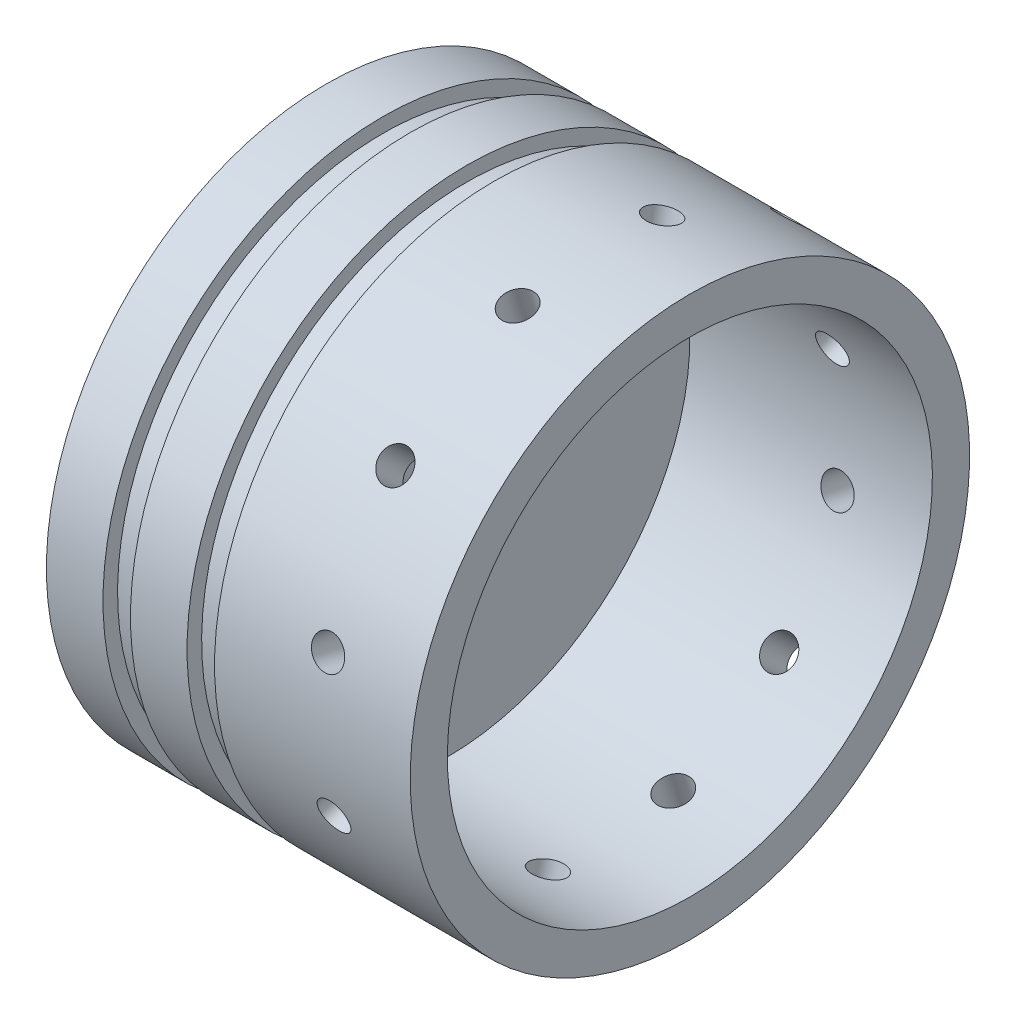
from build123d import *

# Parameters (mm, degrees)
CIRPATTERN1_COUNT = 12


with BuildPart() as part:
    # Sketch1 → Revolve1 (revolve)
    with BuildSketch(Plane.XY, mode=Mode.PRIVATE) as revolve1_sk:
        Polygon((13.208, 43.942), (22.098, 43.942), (22.098, 41.656), (26.416, 41.656), (26.416, 43.942), (57.15, 43.942), (57.15, 38.1), (19.05, 38.1), (19.05, 0), (0, 0), (0, 43.942), (8.89, 43.942), (8.89, 41.656), (13.208, 41.656), align=None)
    revolve(revolve1_sk.sketch.rotate(Axis((0, 0, 0), (1, 0, 0)), 180), axis=Axis((0, 0, 0), (1, 0, 0)))

    # Sketch2 → 1/4-20 Tapped Hole1 (revolve, cut)
    with BuildSketch(Plane(origin=(43.18, 41.943899234, 13.099949659), x_dir=(0, -0.29811910378753365, 0.9545286794837113), z_dir=(1, 0, 0))):
        Polygon((0, 0), (0, 45.474816902), (2.5527, 43.941), (2.5527, 0), align=None)
    f_1_4_20_tapped_hole1 = revolve(axis=Axis((43.18, 48.005156349, 14.993005968), (0, -0.9545286794837113, -0.29811910378753365)), mode=Mode.SUBTRACT)

    # CirPattern1: 1/4-20 Tapped Hole1 ×12 about axis
    cirpattern1_axis = Axis((57.15, 0, 0), (-1, 0, 0))
    for i in range(1, CIRPATTERN1_COUNT):
        add(f_1_4_20_tapped_hole1.rotate(cirpattern1_axis, i * 360 / CIRPATTERN1_COUNT), mode=Mode.SUBTRACT)


solid = part.part
